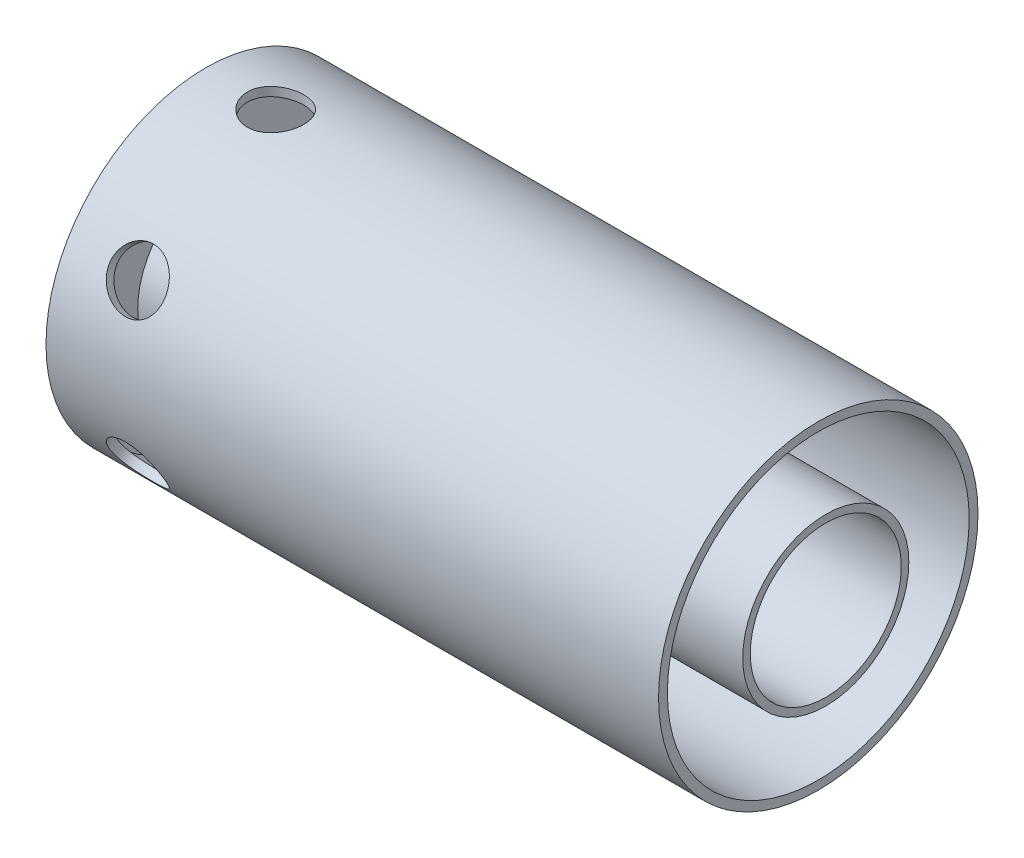
from build123d import *

# Parameters (mm, degrees)
SKETCH9_R           = 9.525
CUT_EXTRUDE9_DEPTH  = 5.842
CUT_EXTRUDE10_START = 40.64
SKETCH10_R          = 9.525
CUT_EXTRUDE10_DEPTH = 40.64
CIRPATTERN1_COUNT   = 3
CIRPATTERN2_COUNT   = 3


with BuildPart() as part:
    # Sketch2 → Revolve2 (revolve)
    with BuildSketch(Plane.XY, mode=Mode.PRIVATE) as revolve2_sk:
        Polygon((0.078657589, 53.975), (0.078657589, 25.527), (209.628657589, 25.527), (209.628657589, 28.067), (127, 28.067), (5.162905757, 28.067), (5.162905757, 50.9905), (207.088657589, 50.9905), (207.088657589, 53.975), align=None)
        Polygon((0.078657589, 53.975), (0.078657589, 25.527), (209.628657589, 25.527), (209.628657589, 28.067), (127, 28.067), (5.162905757, 28.067), (5.162905757, 50.9905), (207.088657589, 50.9905), (207.088657589, 53.975), align=None)
        Polygon((0.078657589, 53.975), (0.078657589, 25.527), (209.628657589, 25.527), (209.628657589, 28.067), (127, 28.067), (5.162905757, 28.067), (5.162905757, 50.9905), (207.088657589, 50.9905), (207.088657589, 53.975), align=None)
    revolve(revolve2_sk.sketch.rotate(Axis((0, 0, 0), (1, 0, 0)), 90), axis=Axis((0, 0, 0), (1, 0, 0)))

    # Sketch9 → Cut-Extrude9 (cut)
    with BuildSketch(Plane(origin=(0, 53.975, 0), x_dir=(1, 0, 0), z_dir=(0, 1, 0))):
        with Locations(Location((23.718923994, 0, 0), (0, 0, 270))):
            Circle(SKETCH9_R)
    cut_extrude9 = extrude(amount=-CUT_EXTRUDE9_DEPTH, mode=Mode.SUBTRACT)

    # Sketch10 → Cut-Extrude10 (cut)
    with BuildSketch(Plane(origin=(0, -53.975, 0), x_dir=(1, 0, 0), z_dir=(0, 1, 0)).offset(CUT_EXTRUDE10_START)):
        with Locations(Location((23.718923994, 0, 0), (0, 0, 270))):
            Circle(SKETCH10_R)
    cut_extrude10 = extrude(amount=-CUT_EXTRUDE10_DEPTH, mode=Mode.SUBTRACT)

    # CirPattern1: Cut-Extrude9 ×3 about axis
    cirpattern1_axis = Axis((0, 0, 0), (-1, 0, 0))
    for i in range(1, CIRPATTERN1_COUNT):
        add(cut_extrude9.rotate(cirpattern1_axis, i * 360 / CIRPATTERN1_COUNT), mode=Mode.SUBTRACT)

    # CirPattern2: Cut-Extrude10 ×3 about axis
    cirpattern2_axis = Axis((0, 0, 0), (-1, 0, 0))
    for i in range(1, CIRPATTERN2_COUNT):
        add(cut_extrude10.rotate(cirpattern2_axis, i * 360 / CIRPATTERN2_COUNT), mode=Mode.SUBTRACT)


solid = part.part
